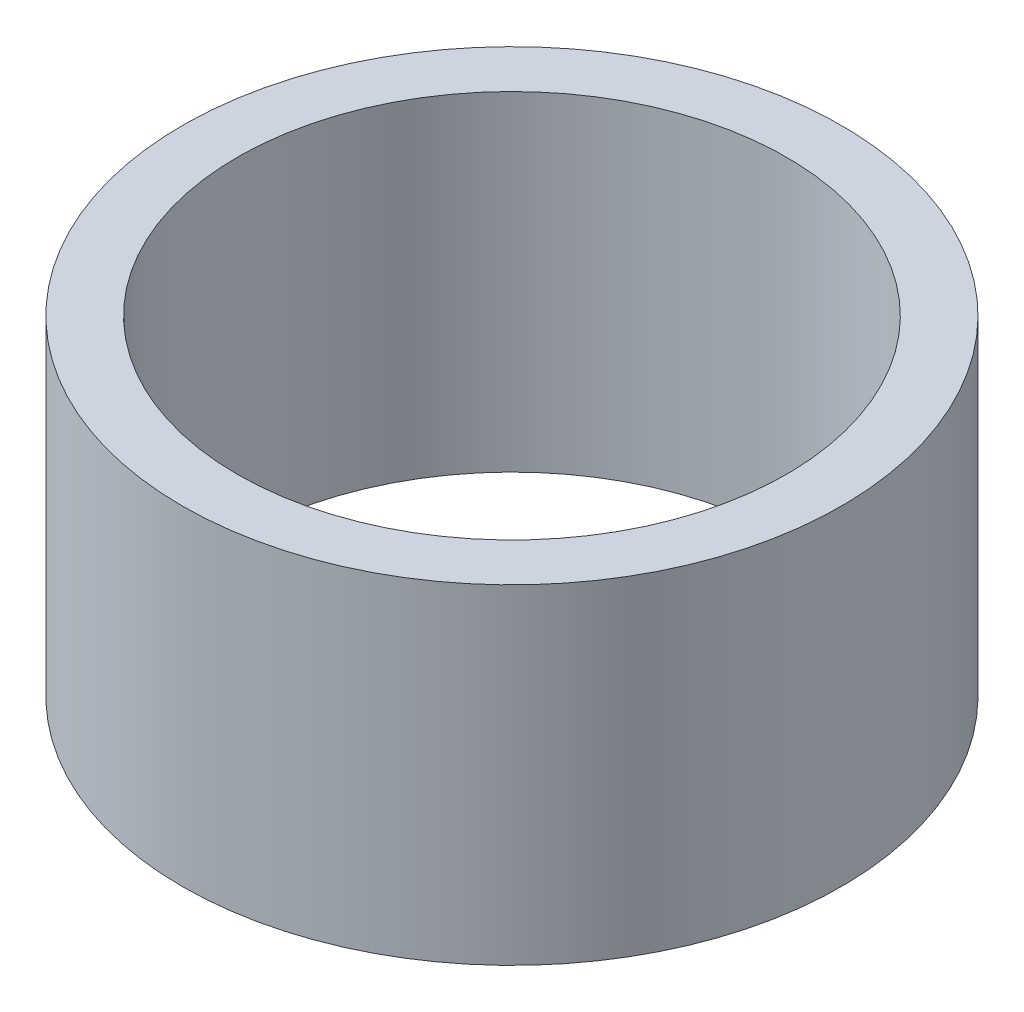
from build123d import *

# Parameters (mm, degrees)
SKETCH_1_R      = 6
SKETCH_1_R_2    = 5
EXTRUDE_1_DEPTH = 6


with BuildPart() as part:
    # 草图1 → 凸台-拉伸1 (new body)
    with BuildSketch(Plane(origin=(0, 0, 0), x_dir=(1, 0, 0), z_dir=(0, 1, 0))):
        with Locations(Location((0, 0, 0), (0, 0, 270))):
            Circle(SKETCH_1_R)
        with Locations(Location((0, 0, 0), (0, 0, 270))):
            Circle(SKETCH_1_R_2, mode=Mode.SUBTRACT)
    extrude(amount=EXTRUDE_1_DEPTH)


solid = part.part
